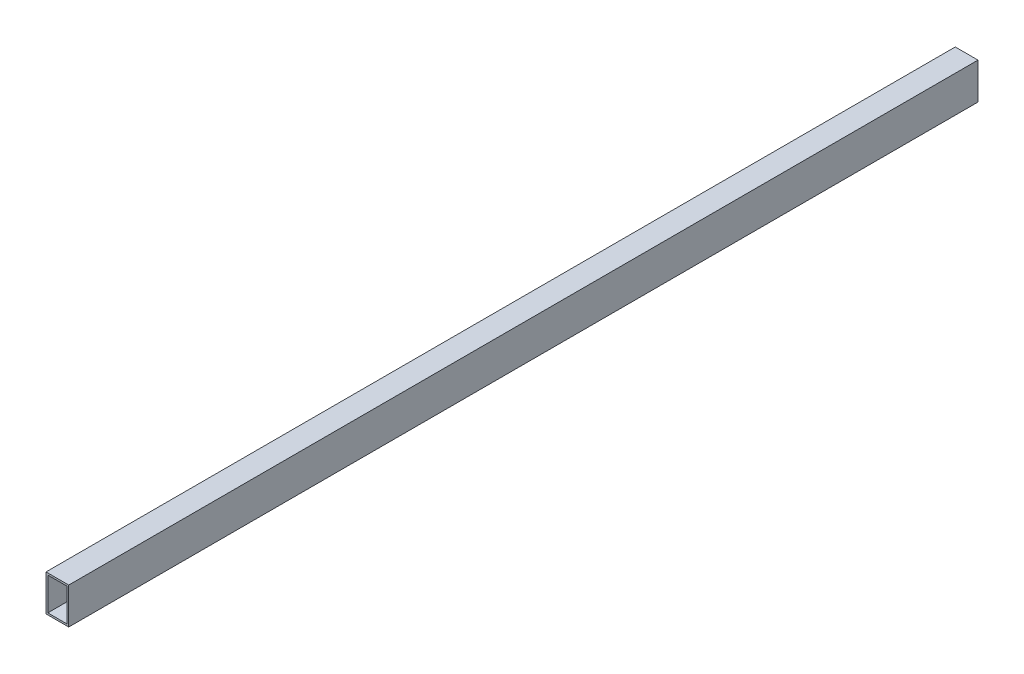
from build123d import *

# Parameters (mm, degrees)
SKETCH1_W           = 50
SKETCH1_H           = 80
BOSS_EXTRUDE1_DEPTH = 2000
SKETCH2_W           = 42
SKETCH2_H           = 72
CUT_EXTRUDE1_DEPTH  = 2000


with BuildPart() as part:
    # Sketch1 → Boss-Extrude1 (new body)
    with BuildSketch(Plane.XY):
        Rectangle(SKETCH1_W, SKETCH1_H)
    extrude(amount=BOSS_EXTRUDE1_DEPTH)

    # Sketch2 → Cut-Extrude1 (cut)
    with BuildSketch(Plane(origin=(0, 0, 0), x_dir=(-1, 0, 0), z_dir=(0, 0, -1))):
        Rectangle(SKETCH2_W, SKETCH2_H)
    extrude(amount=-CUT_EXTRUDE1_DEPTH, mode=Mode.SUBTRACT)


solid = part.part
